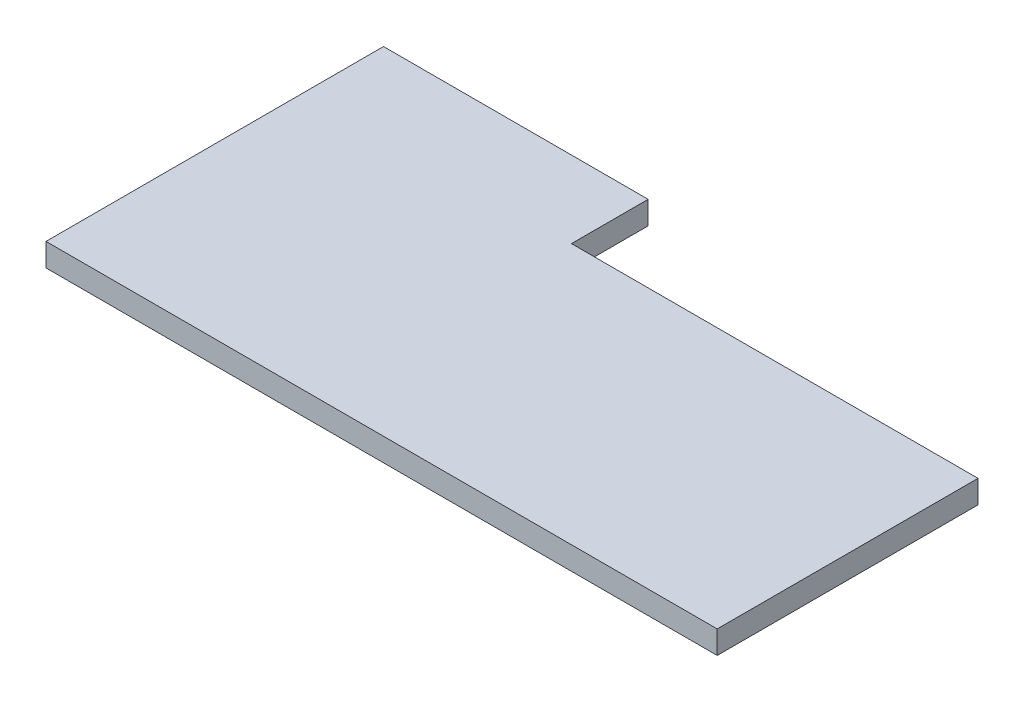
from build123d import *

# Parameters (mm, degrees)
BOSS_EXTRUDE1_DEPTH = 6


with BuildPart() as part:
    # Sketch1 → Boss-Extrude1 (new body)
    with BuildSketch(Plane(origin=(0, 0, 0), x_dir=(1, 0, 0), z_dir=(0, 1, 0))):
        Polygon((0, 0), (175, 0), (175, 68), (69, 68), (69, 88), (0, 88), align=None)
    extrude(amount=BOSS_EXTRUDE1_DEPTH)


solid = part.part
